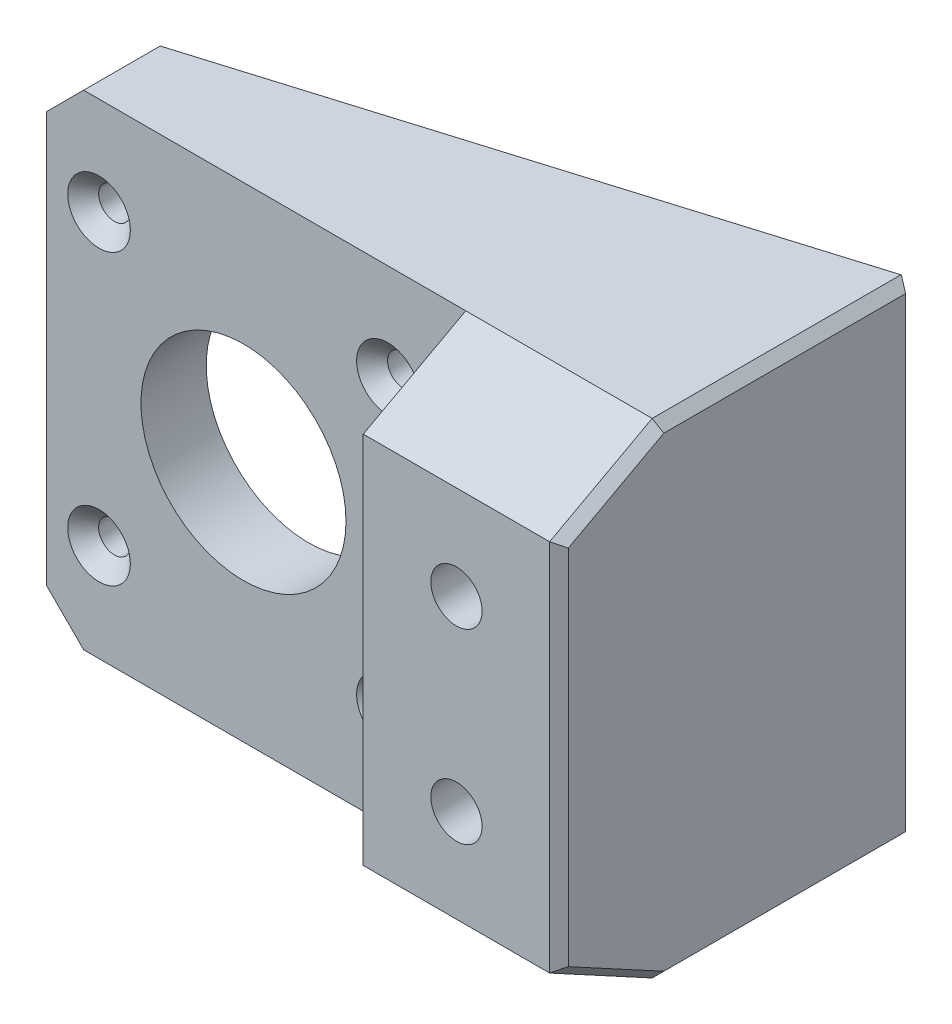
from build123d import *
from OCP.BRepFilletAPI import BRepFilletAPI_MakeChamfer

# Parameters (mm, degrees)
BOSS_EXTRUDE2_DEPTH           = 26
SKETCH5_R                     = 11
CUT_EXTRUDE1_DEPTH            = 52.857979135
CSK_FOR_M3_SFHCS1_D           = 3.4
CSK_FOR_M3_SFHCS1_CSINK_D     = 6.72
CSK_FOR_M3_SFHCS1_CSINK_ANGLE = 90
BOSS_EXTRUDE4_DEPTH           = 52
CUT_EXTRUDE2_DEPTH            = 55.481648286
CBORE_FOR_M5_SHCS1_AT_2_COUNT = 2
CBORE_FOR_M5_SHCS1_AT_2_PITCH = 20
SKETCH13_R                    = 5
CUT_EXTRUDE3_DEPTH            = 55.481648286
CUT_EXTRUDE4_DEPTH            = 56.686623169
CHAMFER1_SIZE                 = 1
CHAMFER1_SIZE2                = 0.80190417
CHAMFER2_SIZE                 = 4


with BuildPart() as part:
    # Sketch3 → Boss-Extrude2 (new, symmetric)
    with BuildSketch(Plane(origin=(0, 0, 0), x_dir=(1, 0, 0), z_dir=(0, 1, 0))):
        Polygon((-22.5, -7), (22.5, -7), (22.5, -18), (43.5, -18), (43.5, 0), (-22.5, 0), align=None)
    extrude(amount=BOSS_EXTRUDE2_DEPTH, both=True)

    # Sketch5 → Cut-Extrude1 (cut, through all)
    with BuildSketch(Plane.XY.offset(7)):
        with Locations((-1.35, 0)):
            Circle(SKETCH5_R)
    extrude(amount=-CUT_EXTRUDE1_DEPTH, mode=Mode.SUBTRACT)

    # CSK for M3 SFHCS1 (through all)
    with Locations(Plane.XY.offset(7)):
        with Locations((-16.85, -15.5), (-16.85, 15.5), (14.15, 15.5), (14.15, -15.5)):
            CounterSinkHole(CSK_FOR_M3_SFHCS1_D / 2, CSK_FOR_M3_SFHCS1_CSINK_D / 2, counter_sink_angle=CSK_FOR_M3_SFHCS1_CSINK_ANGLE)

    # Sketch9 → Boss-Extrude4 (add)
    with BuildSketch(Plane(origin=(0, 26, 0), x_dir=(1, 0, 0), z_dir=(0, 1, 0))):
        Polygon((-22.5, 0), (43.5, 20), (43.5, 0), align=None)
    extrude(amount=-BOSS_EXTRUDE4_DEPTH)

    # Sketch10 → Cut-Extrude2 (cut, through all)
    with BuildSketch(Plane.XY):
        Polygon((19.85, -17.089832201), (19.85, 17.089832201), (15.739832201, 21.2), (-18.439832201, 21.2), (-22.55, 17.089832201), (-22.55, -17.089832201), (-18.439832201, -21.2), (15.739832201, -21.2), align=None)
    extrude(amount=-CUT_EXTRUDE2_DEPTH, mode=Mode.SUBTRACT)

    # Sketch12 → CBORE for M5 SHCS1 (revolve, cut)
    with BuildSketch(Plane(origin=(32.5, 9.958578644, 0), x_dir=(0, 1, 0), z_dir=(1, 0, 0))):
        Polygon((0, 0), (0, 18), (2.75, 18), (2.75, 5), (5, 5), (5, 0), align=None)
    cbore_for_m5_shcs1 = revolve(axis=Axis((32.5, 9.958578644, -6.35), (0, 0, 1)), mode=Mode.SUBTRACT)

    # CBORE for M5 SHCS1 at 2: CBORE for M5 SHCS1 ×2
    with Locations(*[(0, -i * CBORE_FOR_M5_SHCS1_AT_2_PITCH, 0) for i in range(1, CBORE_FOR_M5_SHCS1_AT_2_COUNT)]):
        add(cbore_for_m5_shcs1, mode=Mode.SUBTRACT)

    # Sketch13 → Cut-Extrude3 (cut, through all)
    with BuildSketch(Plane.XY):
        with Locations(Location((32.5, -10.041421356, 0), (0, 0, 180))):
            Circle(SKETCH13_R)
        with Locations(Location((32.5, 9.958578644, 0), (0, 0, 180))):
            Circle(SKETCH13_R)
    extrude(amount=-CUT_EXTRUDE3_DEPTH, mode=Mode.SUBTRACT)

    # Sketch14 → Cut-Extrude4 (cut, through all)
    with BuildSketch(Plane.ZY.offset(-22.5)):
        Polygon((7, -26), (18, -20.041421356), (18, -26), align=None)
    cut_extrude4 = extrude(amount=-CUT_EXTRUDE4_DEPTH, mode=Mode.SUBTRACT)

    # Mirror2: Cut-Extrude4 across plane
    add(cut_extrude4.mirror(Plane.ZX), mode=Mode.SUBTRACT)

    # Chamfer1: one chamfer whose edges measure the first distance from different faces: ONE call of the kernel's chamfer builder (chamfer() names one face for all edges)
    chamfer1_edges_1 = [part.edges().sort_by_distance(p)[0] for p in [
        (43.5, -26, -6.5),
        (43.5, -23.020710678, 12.5),
        (43.5, 26, -6.5),
        (43.5, 0, 18),
        (43.5, 23.020710678, 12.5),
    ]]
    chamfer1_edges_2 = [part.edges().sort_by_distance(p)[0] for p in [
        (43.5, 0, -20),
    ]]
    chamfer1_side_2 = [part.faces().sort_by_distance(p)[0] for p in [
        (21.99684701, 0.004301334, -13.483893033),
    ]]
    chamfer1 = BRepFilletAPI_MakeChamfer(part.part.solid().wrapped)
    for e in chamfer1_edges_1:
        chamfer1.Add(CHAMFER1_SIZE, e.wrapped)
    for e in chamfer1_edges_2:
        chamfer1.Add(CHAMFER1_SIZE, CHAMFER1_SIZE2, e.wrapped, chamfer1_side_2[0].wrapped)  # the first distance lies on this face
    add(Compound.cast(chamfer1.Shape()), mode=Mode.REPLACE)

    # Chamfer2
    chamfer2_edges = [part.edges().sort_by_distance(p)[0] for p in [
        (-22.5, 26, 3.5),
        (-22.5, -26, 3.5),
    ]]
    chamfer(chamfer2_edges, length=CHAMFER2_SIZE)


solid = part.part
